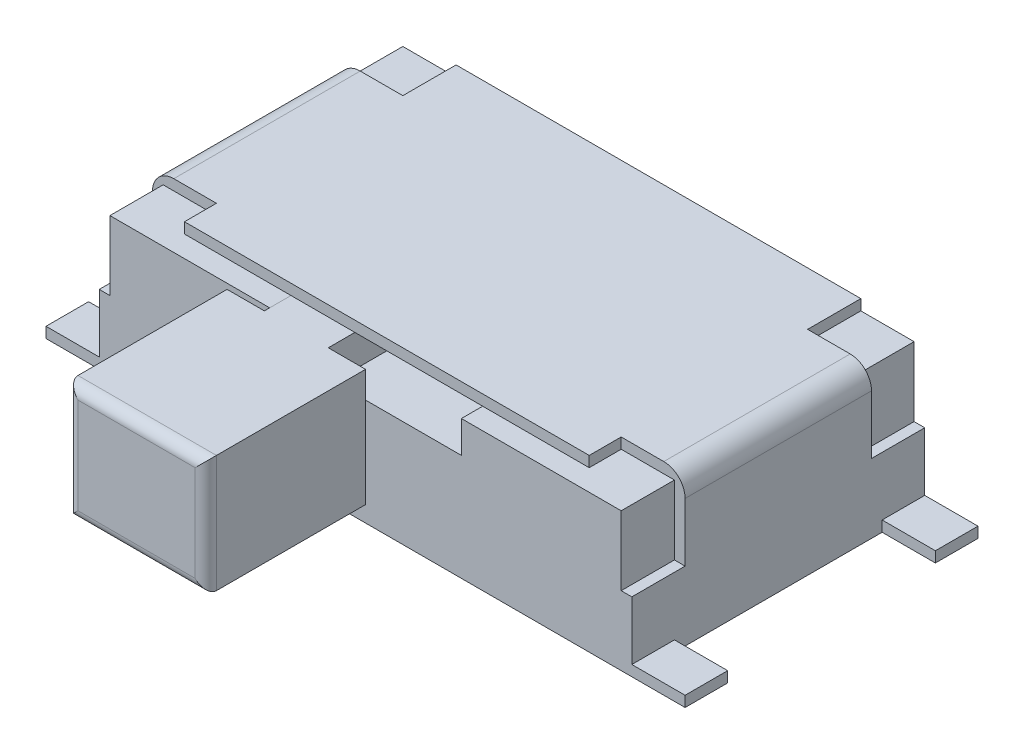
from build123d import *

# Parameters (mm, degrees)
SKETCH_1_W          = 4.8
SKETCH_1_H          = 2.75
EXTRUDE_1_DEPTH     = 1.3
SKETCH_2_W          = 0.1
SKETCH_2_H          = 1.75
EXTRUDE_3_DEPTH     = 0.1
EXTRUDE_4_DEPTH     = 0.1
SKETCH_4_W          = 0.4
SKETCH_4_H          = 0.1
EXTRUDE_5_DEPTH     = 0.5
SKETCH_5_W          = 3.8
SKETCH_5_H          = 0.2
CUT_EXTRUDE_1_DEPTH = 0.1
SKETCH_6_W          = 1.8
SKETCH_6_H          = 0.3
CUT_EXTRUDE_2_DEPTH = 1
SKETCH_7_W          = 0.6
SKETCH_7_H          = 0.3
EXTRUDE_6_DEPTH     = 1.05
SKETCH_8_W          = 1.3
SKETCH_8_H          = 1.1
EXTRUDE_7_DEPTH     = 1.5
SKETCH_9_W          = 0.4
SKETCH_9_H          = 0.15
EXTRUDE_8_DEPTH     = 0.9
FILLET_1_R          = 0.2
FILLET_2_R          = 0.1
SKETCH_10_R         = 0.3815
EXTRUDE_9_DEPTH     = 0.5
FILLET_3_R          = 0.2


with BuildPart() as part:
    # 草图1 → 凸台-拉伸1 (new body)
    with BuildSketch(Plane(origin=(0, 0, 0), x_dir=(1, 0, 0), z_dir=(0, 1, 0))):
        with Locations((2.4, 1.375)):
            Rectangle(SKETCH_1_W, SKETCH_1_H)
    extrude(amount=EXTRUDE_1_DEPTH)



with BuildPart() as body_2:
    # 草图2 → 凸台-拉伸3 (new body)
    with BuildSketch(Plane(origin=(0, 1.3, 0), x_dir=(1, 0, 0), z_dir=(0, 1, 0))):
        Polygon((0.5, 2.25), (0, 2.25), (0, 1.375), (0, 0.5), (0.5, 0.5), (0.5, 0), (4.3, 0), (4.3, 0.5), (4.8, 0.5), (4.8, 2.25), (4.3, 2.25), (4.3, 2.75), (0.5, 2.75), align=None)
        Polygon((0, 1.375), (0, 2.25), (-0.1, 2.25), (-0.1, 0.5), (0, 0.5), align=None)
        with Locations((4.85, 1.375)):
            Rectangle(SKETCH_2_W, SKETCH_2_H)
    extrude(amount=EXTRUDE_3_DEPTH)


with BuildPart() as part_1:
    add(part.part)

    add(body_2.part)  # 凸台-拉伸4 merges body 2
    # 草图3 → 凸台-拉伸4 (add)
    with BuildSketch(Plane.ZY):
        Polygon((-2.75, 0), (0, 0), (0, 0.65), (-0.5, 0.65), (-0.5, 1.3), (-2.25, 1.3), (-2.25, 0.65), (-2.75, 0.65), align=None)
    extrude(amount=EXTRUDE_4_DEPTH)


with BuildPart() as body_2_2:
    # 镜向16: mirrored copy
    add(part_1.part.mirror(Plane(origin=(2.4, 0, 0), x_dir=(0, 0, 1), z_dir=(1, 0, 0))))


with BuildPart() as part_2:
    add(part_1.part)

    add(body_2_2.part)  # 凸台-拉伸5 merges body 2 2
    # 草图4 → 凸台-拉伸5 (add)
    with BuildSketch(Plane.ZY.offset(0.1)):
        with Locations((-2.55, 0.05)):
            Rectangle(SKETCH_4_W, SKETCH_4_H)
        with Locations((-0.2, 0.05)):
            Rectangle(SKETCH_4_W, SKETCH_4_H)
    extrude(amount=EXTRUDE_5_DEPTH)

    # 镜向17: part across plane


with BuildPart() as part_3:
    add(part_2.part)
    add(part_2.part.mirror(Plane(origin=(2.4, 0, 0), x_dir=(0, 0, 1), z_dir=(1, 0, 0))))

    # 草图5 → 切除-拉伸1 (cut)
    with BuildSketch(Plane(origin=(0, 1.4, 0), x_dir=(1, 0, 0), z_dir=(0, 1, 0))):
        with Locations((2.4, 0.1)):
            Rectangle(SKETCH_5_W, SKETCH_5_H)
    extrude(amount=-CUT_EXTRUDE_1_DEPTH, mode=Mode.SUBTRACT)

    # 草图6 → 切除-拉伸2 (cut)
    with BuildSketch(Plane.XY):
        with Locations((2.4, 1.15)):
            Rectangle(SKETCH_6_W, SKETCH_6_H)
    extrude(amount=-CUT_EXTRUDE_2_DEPTH, mode=Mode.SUBTRACT)

    # 草图9 → 凸台-拉伸8 (add)
    with BuildSketch(Plane(origin=(0, 0, -2.75), x_dir=(-1, 0, 0), z_dir=(0, 0, -1))):
        with Locations((-1.4, 0.075)):
            Rectangle(SKETCH_9_W, SKETCH_9_H)
        with Locations((-2.4, 0.075)):
            Rectangle(SKETCH_9_W, SKETCH_9_H)
        with Locations((-3.4, 0.075)):
            Rectangle(SKETCH_9_W, SKETCH_9_H)
    extrude(amount=EXTRUDE_8_DEPTH)

    # 圆角1
    fillet_1_edges = [part_3.edges().sort_by_distance(p)[0] for p in [
        (4.9, 1.4, -1.375),
        (-0.1, 1.4, -1.375),
    ]]
    fillet(fillet_1_edges, radius=FILLET_1_R)

    # 草图10 → 凸台-拉伸9 (add)
    with BuildSketch(Plane.XZ):
        with Locations(Location((0.9, -1.375, 0), (0, 0, 270))):
            Circle(SKETCH_10_R)
        with Locations(Location((3.9, -1.375, 0), (0, 0, 90))):
            Circle(SKETCH_10_R)
    extrude(amount=EXTRUDE_9_DEPTH)

    # 圆角3
    fillet_3_edges = [part_3.edges().sort_by_distance(p)[0] for p in [
        (0.9, -0.5, -0.9935),
        (3.9, -0.5, -1.7565),
    ]]
    fillet(fillet_3_edges, radius=FILLET_3_R)


with BuildPart() as body_2_3:
    # 草图7 → 凸台-拉伸6 (new body)
    with BuildSketch(Plane.XY.offset(-1)):
        with Locations((1.8, 1.15)):
            Rectangle(SKETCH_7_W, SKETCH_7_H)
    extrude(amount=EXTRUDE_6_DEPTH)

    # 草图8 → 凸台-拉伸7 (add)
    with BuildSketch(Plane.XY.offset(0.05)):
        with Locations((1.8, 0.75)):
            Rectangle(SKETCH_8_W, SKETCH_8_H)
    extrude(amount=EXTRUDE_7_DEPTH)

    # 圆角2
    fillet_2_edges = [body_2_3.edges().sort_by_distance(p)[0] for p in [
        (1.15, 0.75, 1.55),
        (1.8, 0.2, 1.55),
        (2.45, 0.75, 1.55),
        (1.8, 1.3, 1.55),
    ]]
    fillet(fillet_2_edges, radius=FILLET_2_R)


solid = Compound([part_3.part, body_2_3.part])
